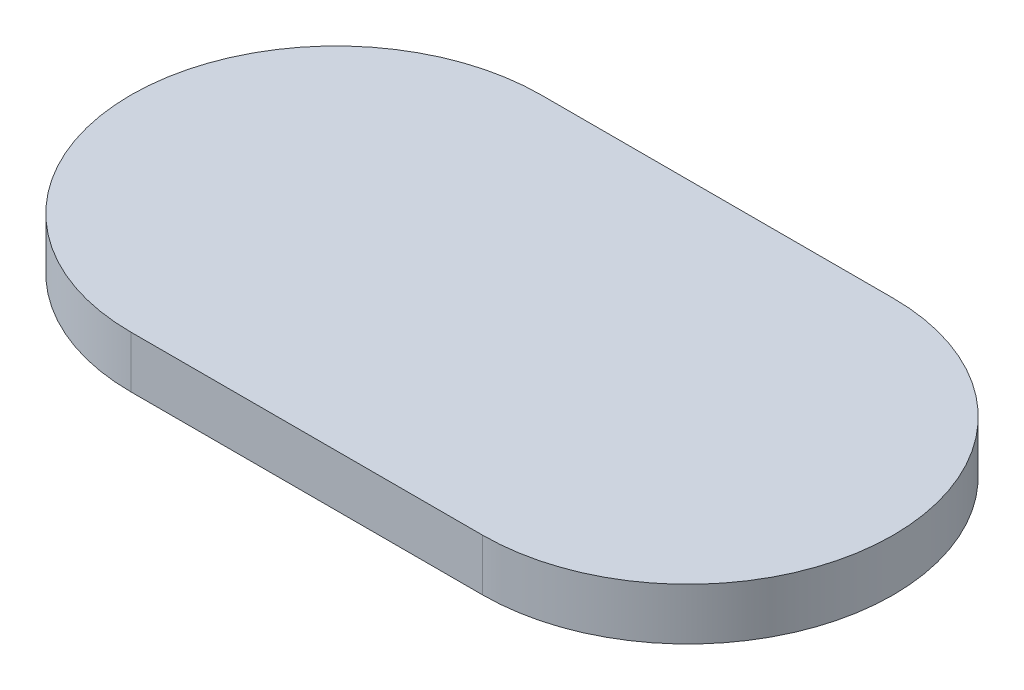
from build123d import *

# Parameters (mm, degrees)
BOSS_EXTRU_1_DEPTH = 3
ESQUISSE2_R        = 3.25
ESQUISSE2_R_2      = 1.75
BOSS_EXTRU_2_DEPTH = 5
ESQUISSE3_R        = 2.5
ESQUISSE3_R_2      = 1
BOSS_EXTRU_3_DEPTH = 2.5


with BuildPart() as part:
    # Esquisse1 → Boss.-Extru.1 (new body)
    with BuildSketch(Plane(origin=(0, 0, 0), x_dir=(1, 0, 0), z_dir=(0, 1, 0))):
        with BuildLine():
            Line((10.2, -11.9), (-10.2, -11.9))
            ThreePointArc((-10.2, -11.9), (-22.1, 0), (-10.2, 11.9))
            Line((-10.2, 11.9), (10.2, 11.9))
            ThreePointArc((10.2, 11.9), (22.1, 0), (10.2, -11.9))
        make_face()
    extrude(amount=BOSS_EXTRU_1_DEPTH)

    # Esquisse2 → Boss.-Extru.2 (add)
    with BuildSketch(Plane.XZ):
        with Locations(Location((-10.2, 0, 0), (0, 0, 90))):
            Circle(ESQUISSE2_R)
        with Locations(Location((10.2, 0, 0), (0, 0, 90))):
            Circle(ESQUISSE2_R_2)
    extrude(amount=BOSS_EXTRU_2_DEPTH)

    # Esquisse3 → Boss.-Extru.3 (add)
    with BuildSketch(Plane.XZ.offset(5)):
        with Locations(Location((-10.2, 0, 0), (0, 0, 270))):
            Circle(ESQUISSE3_R)
        with Locations(Location((10.2, 0, 0), (0, 0, 270))):
            Circle(ESQUISSE3_R_2)
    extrude(amount=BOSS_EXTRU_3_DEPTH)


solid = part.part
